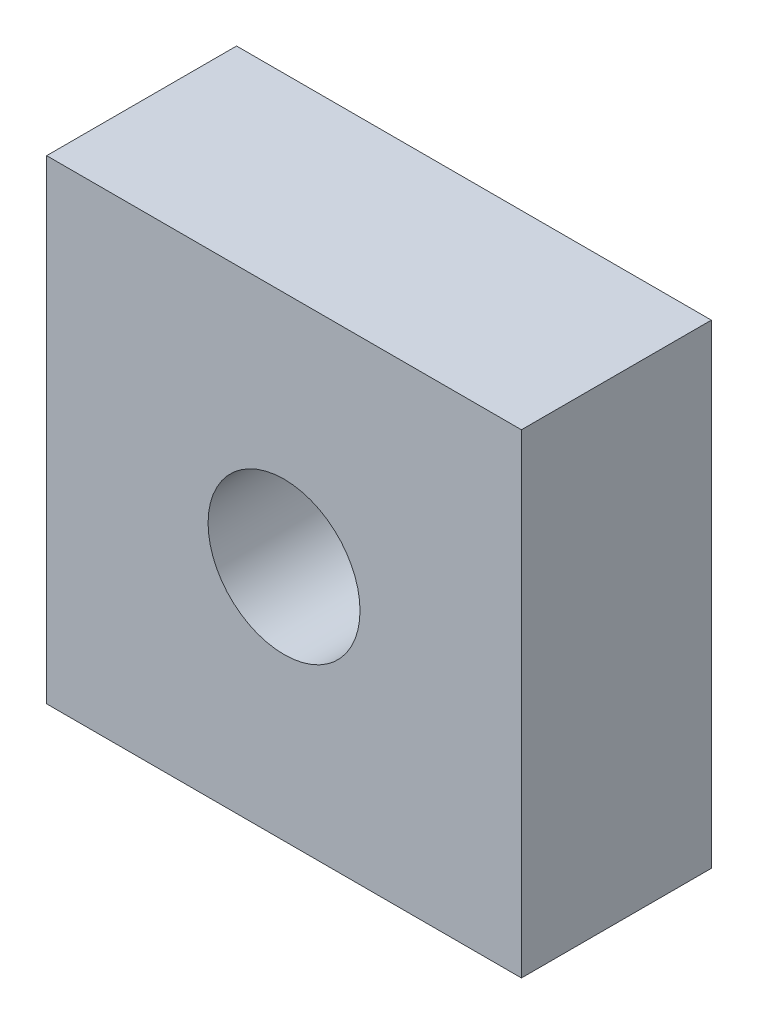
from build123d import *

# Parameters (mm, degrees)
SKETCH_1_W      = 10
SKETCH_1_H      = 10
SKETCH_1_R      = 1.6
EXTRUDE_1_DEPTH = 4


with BuildPart() as part:
    # 草图1 → 凸台-拉伸1 (new body)
    with BuildSketch(Plane.XY):
        with Locations((5, 5)):
            Rectangle(SKETCH_1_W, SKETCH_1_H)
        with Locations((5, 5)):
            Circle(SKETCH_1_R, mode=Mode.SUBTRACT)
    extrude(amount=EXTRUDE_1_DEPTH)


solid = part.part
